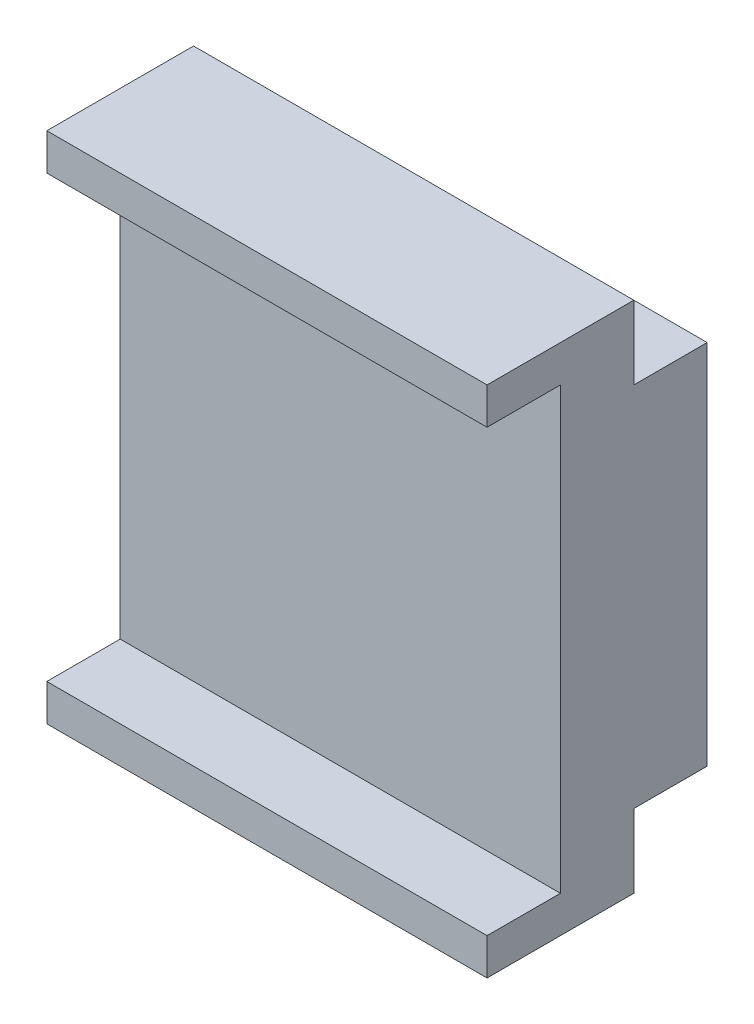
from build123d import *

# Parameters (mm, degrees)
SKETCH1_W           = 5
SKETCH1_H           = 25
SKETCH1_H_2         = 35
SKETCH1_H_3         = 2.5
BOSS_EXTRUDE1_DEPTH = 30


with BuildPart() as part:
    # Sketch1 → Boss-Extrude1 (new body)
    with BuildSketch(Plane(origin=(0, 0, 0), x_dir=(0, 0, -1), z_dir=(1, 0, 0))):
        with Locations((7.5, 17.5)):
            Rectangle(SKETCH1_W, SKETCH1_H)
        with Locations((2.5, 17.5)):
            Rectangle(SKETCH1_W, SKETCH1_H_2)
        with Locations((-2.5, 33.75)):
            Rectangle(SKETCH1_W, SKETCH1_H_3)
        with Locations((-2.5, 1.25)):
            Rectangle(SKETCH1_W, SKETCH1_H_3)
    extrude(amount=BOSS_EXTRUDE1_DEPTH)


solid = part.part
